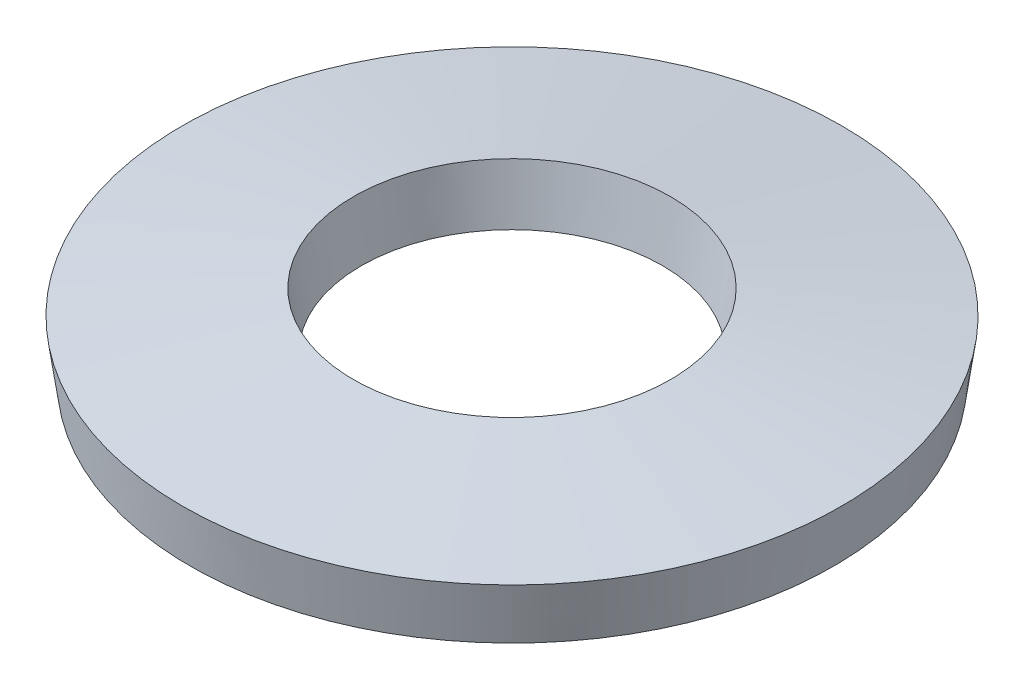
from build123d import *


with BuildPart() as part:
    # Sketch1 → Revolve1 (revolve)
    with BuildSketch(Plane.XY, mode=Mode.PRIVATE) as revolve1_sk:
        Polygon((3.416303183, 0), (1.6, 0.255866309), (1.683696817, 0.85), (3.5, 0.594133691), align=None)
    revolve(revolve1_sk.sketch.rotate(Axis((0, 0, 0), (0, 1, 0)), 90), axis=Axis((0, 0, 0), (0, 1, 0)))


solid = part.part
